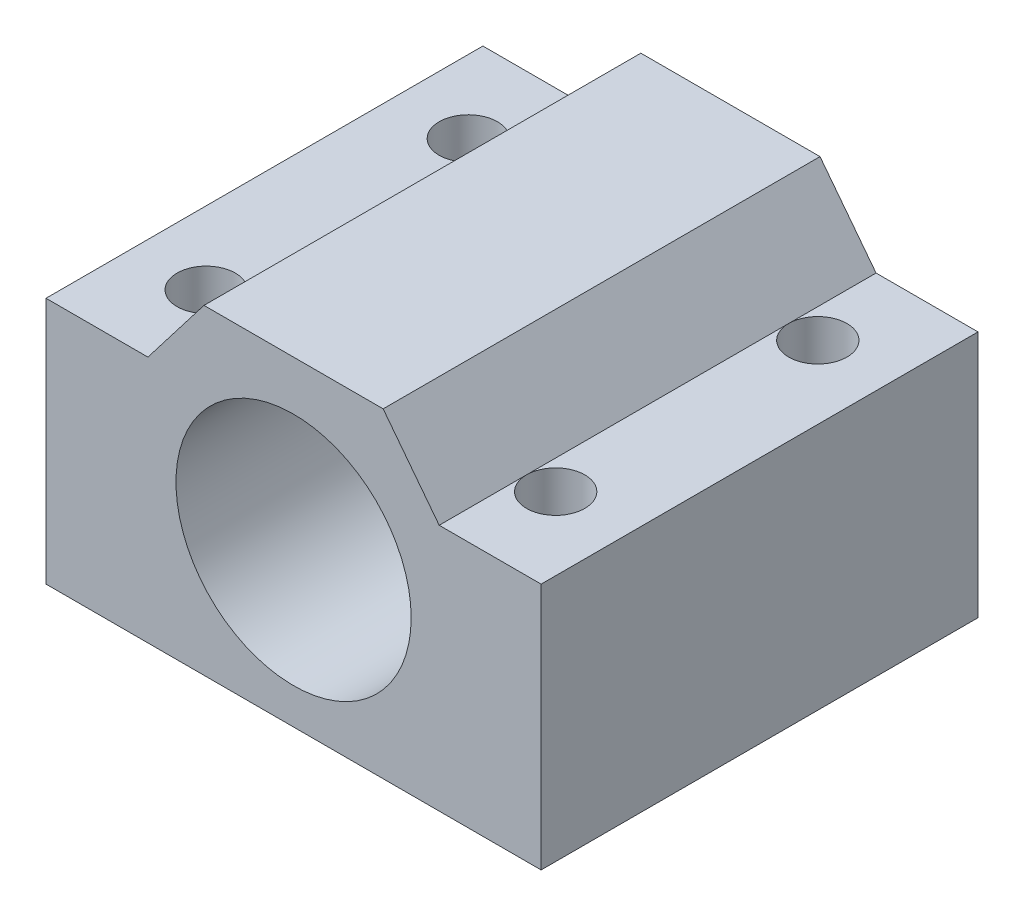
from build123d import *

# Parameters (mm, degrees)
SKETCH_1_W          = 34
SKETCH_1_H          = 30
SKETCH_1_R          = 2
EXTRUDE_1_DEPTH     = 17
EXTRUDE_3_REACH     = 41.002
SKETCH_4_R          = 8.07551033
CUT_EXTRUDE_1_DEPTH = 30


with BuildPart() as part:
    # 草图1 → 凸台-拉伸1 (new body)
    with BuildSketch(Plane(origin=(0, 0, 0), x_dir=(1, 0, 0), z_dir=(0, 1, 0))):
        with Locations((1.225705329, 2.956112853)):
            Rectangle(SKETCH_1_W, SKETCH_1_H)
        with Locations(Location((-10.774294671, 11.956112853, 0), (0, 0, 270))):
            Circle(SKETCH_1_R, mode=Mode.SUBTRACT)
        with Locations(Location((13.225705329, 11.956112853, 0), (0, 0, 90))):
            Circle(SKETCH_1_R, mode=Mode.SUBTRACT)
        with Locations(Location((13.225705329, -6.043887147, 0), (0, 0, 270))):
            Circle(SKETCH_1_R, mode=Mode.SUBTRACT)
        with Locations(Location((-10.774294671, -6.043887147, 0), (0, 0, 90))):
            Circle(SKETCH_1_R, mode=Mode.SUBTRACT)
    extrude(amount=EXTRUDE_1_DEPTH)

    # 凸台-拉伸3: up to this face of the body (flat: up to its plane)
    extrude_3_end = Plane(part.part.faces().sort_by_distance((1.225705329, 8.5, -17.956112853))[0])
    # 草图3 → 凸台-拉伸3 (add, up to the picked face)
    with BuildSketch(Plane.XY.offset(12.043887147), mode=Mode.PRIVATE) as extrude_3_sk1:
        Polygon((-4.926354977, 22), (-8.774294671, 17), (1.225705329, 17), (11.225705329, 17), (7.377765635, 22), align=None)
    extrude_3_tool1 = split(extrude(extrude_3_sk1.sketch, amount=-EXTRUDE_3_REACH, mode=Mode.PRIVATE), bisect_by=extrude_3_end, keep=Keep.BOTH, mode=Mode.PRIVATE)
    add(extrude_3_tool1.solids().sort_by(Axis((1.225705, 19.301473, 12.043887), (0, 0, -1)))[0])

    # 草图4 → 切除-拉伸1 (cut)
    with BuildSketch(Plane.XY.offset(12.043887147)):
        with Locations((1.225705329, 10.534716584)):
            Circle(SKETCH_4_R)
    extrude(amount=-CUT_EXTRUDE_1_DEPTH, mode=Mode.SUBTRACT)


solid = part.part
